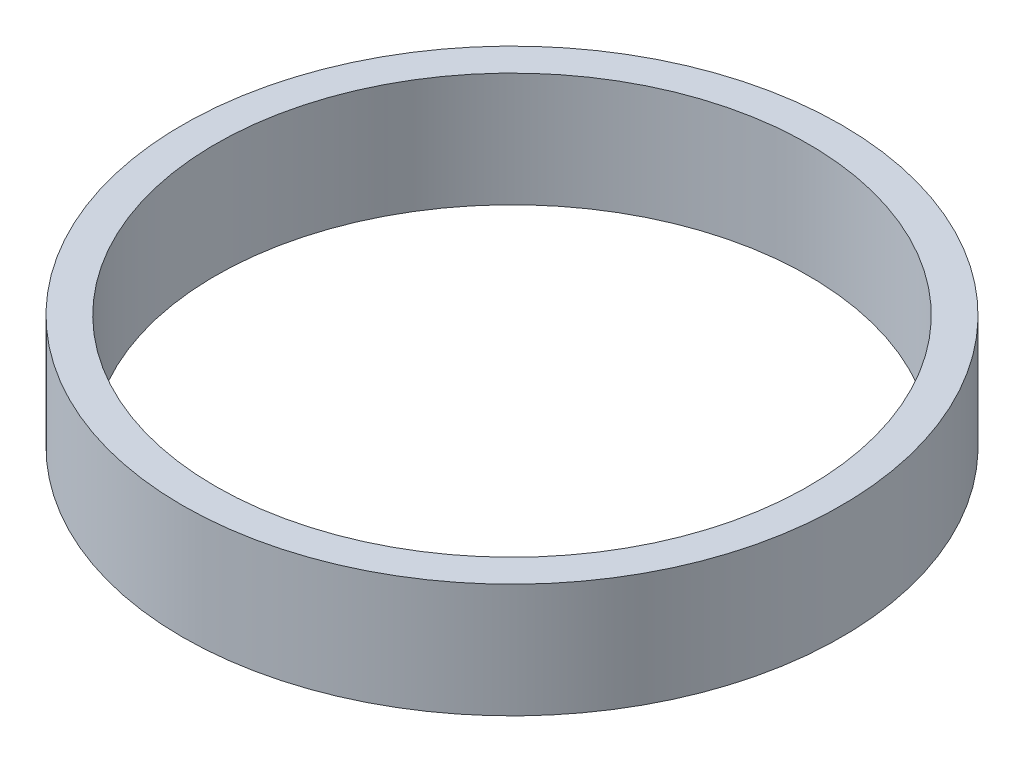
from build123d import *

# Parameters (mm, degrees)
SKETCH1_R           = 28.9
SKETCH1_R_2         = 26
BOSS_EXTRUDE1_DEPTH = 10


with BuildPart() as part:
    # Sketch1 → Boss-Extrude1 (new body)
    with BuildSketch(Plane(origin=(0, 0, 0), x_dir=(1, 0, 0), z_dir=(0, 1, 0))):
        with Locations(Location((0, 0, 0), (0, 0, 270))):
            Circle(SKETCH1_R)
        with Locations(Location((0, 0, 0), (0, 0, 270))):
            Circle(SKETCH1_R_2, mode=Mode.SUBTRACT)
    extrude(amount=BOSS_EXTRUDE1_DEPTH)


solid = part.part
